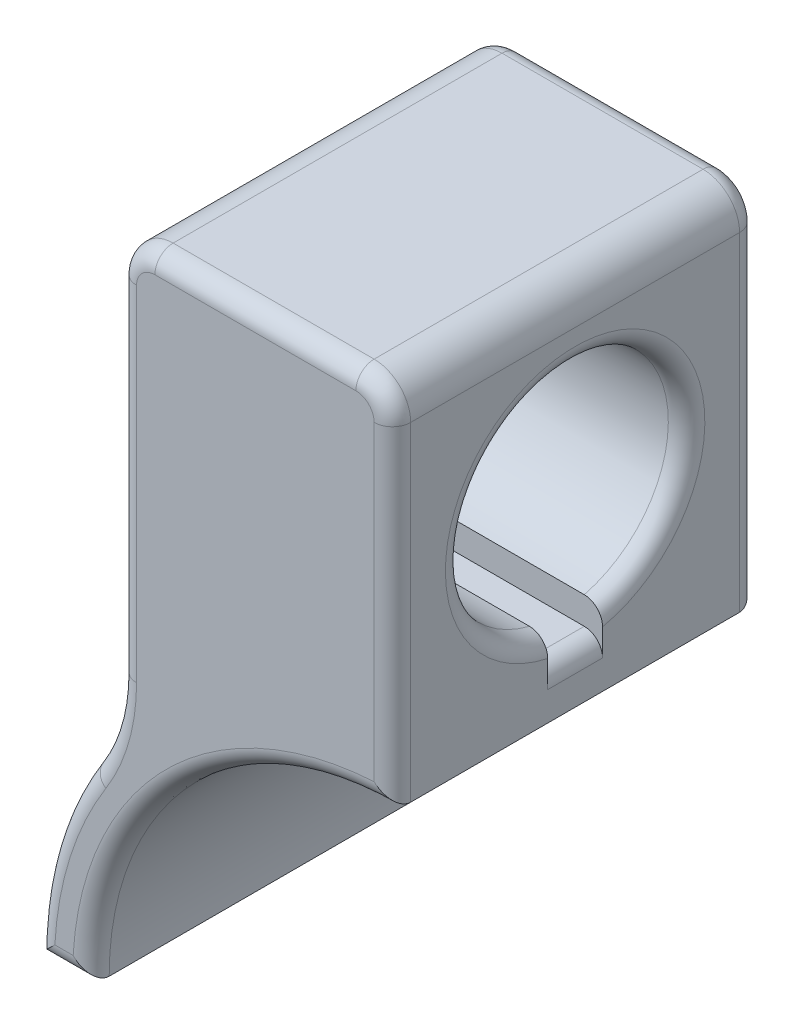
from build123d import *

# Parameters (mm, degrees)
BOSS_EXTRUDE1_DEPTH = 20
CUT_EXTRUDE1_DEPTH  = 46.961940777
FILLET1_R           = 1
FILLET2_R           = 1
FILLET3_R           = 1


with BuildPart() as part:
    # Sketch1 → Boss-Extrude1 (new body)
    with BuildSketch(Plane.XY):
        with BuildLine():
            Line((-19.5, 0), (-16.5, 0))
            ThreePointArc((-16.5, 0), (-11.66726189, 11.66726189), (0, 16.5))
            Line((0, 16.5), (0, 34.5))
            ThreePointArc((0, 34.5), (-0.585786438, 35.914213562), (-2, 36.5))
            Line((-2, 36.5), (-13, 36.5))
            ThreePointArc((-13, 36.5), (-14.414213562, 35.914213562), (-15, 34.5))
            Line((-15, 34.5), (-15, 15.660459763))
            ThreePointArc((-15, 15.660459763), (-15.388918825, 12.89873591), (-16.525423729, 10.351829335))
            ThreePointArc((-16.525423729, 10.351829335), (-18.741608292, 5.385361515), (-19.5, 0))
        make_face()
    extrude(amount=BOSS_EXTRUDE1_DEPTH)

    # Sketch2 → Cut-Extrude1 (cut, through all)
    with BuildSketch(Plane(origin=(0, 0, 0), x_dir=(0, 0, -1), z_dir=(1, 0, 0))):
        with BuildLine():
            Line((-11.5, 19.0873018), (-8.5, 19.0873018))
            Line((-8.5, 19.0873018), (-8.5, 20.5873018))
            ThreePointArc((-8.5, 20.5873018), (-10, 32.6), (-11.5, 20.5873018))
            Line((-11.5, 20.5873018), (-11.5, 19.0873018))
        make_face()
    extrude(amount=-CUT_EXTRUDE1_DEPTH, mode=Mode.SUBTRACT)

    # Fillet1
    fillet1_edges = [part.edges().sort_by_distance(p)[0] for p in [
        (-15, 19.0873018, 10),
        (0, 19.0873018, 10),
    ]]
    fillet(fillet1_edges, radius=FILLET1_R)

    # Fillet2
    fillet2_edges = [part.edges().sort_by_distance(p)[0] for p in [
        (-15, 32.6, 10),
        (0, 32.6, 10),
    ]]
    fillet(fillet2_edges, radius=FILLET2_R)

    # Fillet3
    fillet3_edges = [part.edges().sort_by_distance(p)[0] for p in [
        (-11.66726189, 11.66726189, 20),
        (-0.585786438, 35.914213562, 0),
        (0, 25.5, 0),
        (-11.66726189, 11.66726189, 0),
        (-18, 0, 0),
        (-18.741608292, 5.385361515, 0),
        (0, 25.5, 20),
        (-0.585786438, 35.914213562, 20),
        (-7.5, 36.5, 20),
        (-14.414213562, 35.914213562, 20),
        (-15, 25.080229882, 20),
        (-15.388918825, 12.89873591, 20),
        (-18.741608292, 5.385361515, 20),
        (-18, 0, 20),
        (-15.388918825, 12.89873591, 0),
        (-15, 25.080229882, 0),
        (-14.414213562, 35.914213562, 0),
        (-7.5, 36.5, 0),
    ]]
    fillet(fillet3_edges, radius=FILLET3_R)


solid = part.part
